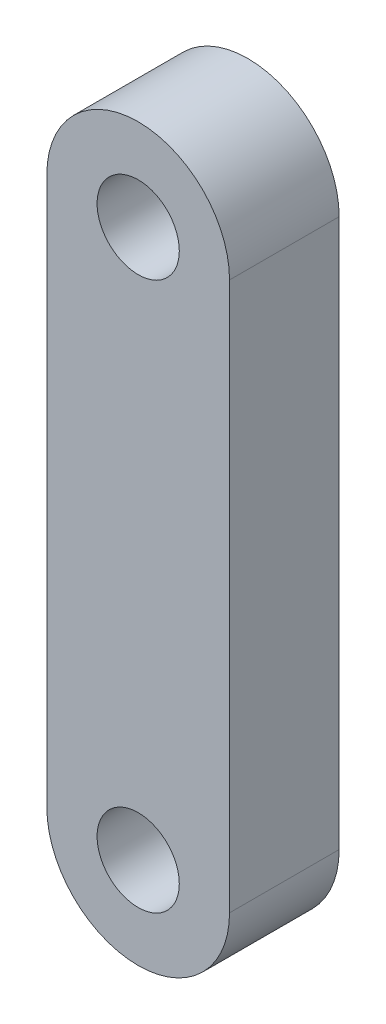
from build123d import *

# Parameters (mm, degrees)
SALIENTE_EXTRUIR1_DEPTH      = 3
TALADRO_DE_MARGEN_PARA_M41_D = 4.5


with BuildPart() as part:
    # Croquis1 → Saliente-Extruir1 (new, symmetric)
    with BuildSketch(Plane.XY):
        with BuildLine():
            Line((-5, -15), (-5, 15))
            ThreePointArc((-5, 15), (0, 20), (5, 15))
            Line((5, 15), (5, -15))
            ThreePointArc((5, -15), (0, -20), (-5, -15))
        make_face()
    extrude(amount=SALIENTE_EXTRUIR1_DEPTH, both=True)

    # Taladro de margen para M41 (through all)
    with Locations(Plane.XY.offset(3)):
        with Locations((0, 15), (0, -15)):
            Hole(TALADRO_DE_MARGEN_PARA_M41_D / 2)


solid = part.part
